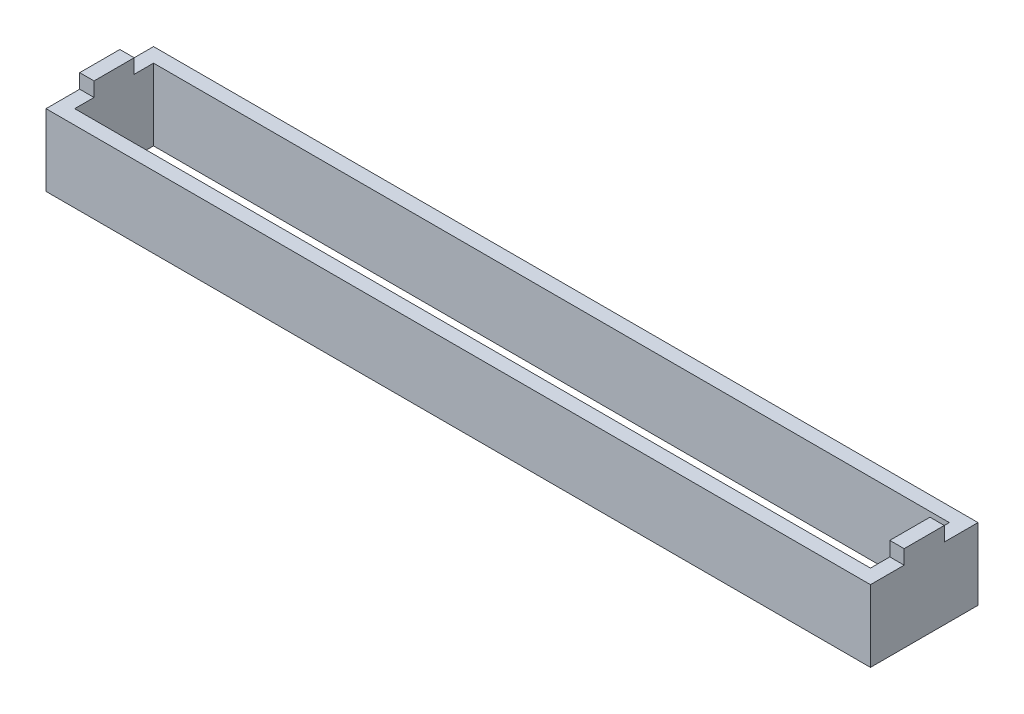
from build123d import *

# Parameters (mm, degrees)
SKETCH1_W           = 115
SKETCH1_H           = 15
SKETCH1_W_2         = 111
SKETCH1_H_2         = 11
BOSS_EXTRUDE1_DEPTH = 10
SKETCH2_W           = 2
SKETCH2_H           = 5.6
BOSS_EXTRUDE2_DEPTH = 2


with BuildPart() as part:
    # Sketch1 → Boss-Extrude1 (new body)
    with BuildSketch(Plane(origin=(0, 0, 0), x_dir=(1, 0, 0), z_dir=(0, 1, 0))):
        Rectangle(SKETCH1_W, SKETCH1_H)
        Rectangle(SKETCH1_W_2, SKETCH1_H_2, mode=Mode.SUBTRACT)
    extrude(amount=BOSS_EXTRUDE1_DEPTH)

    # Sketch2 → Boss-Extrude2 (add)
    with BuildSketch(Plane(origin=(0, 10, 0), x_dir=(1, 0, 0), z_dir=(0, 1, 0))):
        with Locations((-56.5, 0)):
            Rectangle(SKETCH2_W, SKETCH2_H)
        with Locations((56.5, 0)):
            Rectangle(SKETCH2_W, SKETCH2_H)
    extrude(amount=BOSS_EXTRUDE2_DEPTH)


solid = part.part
